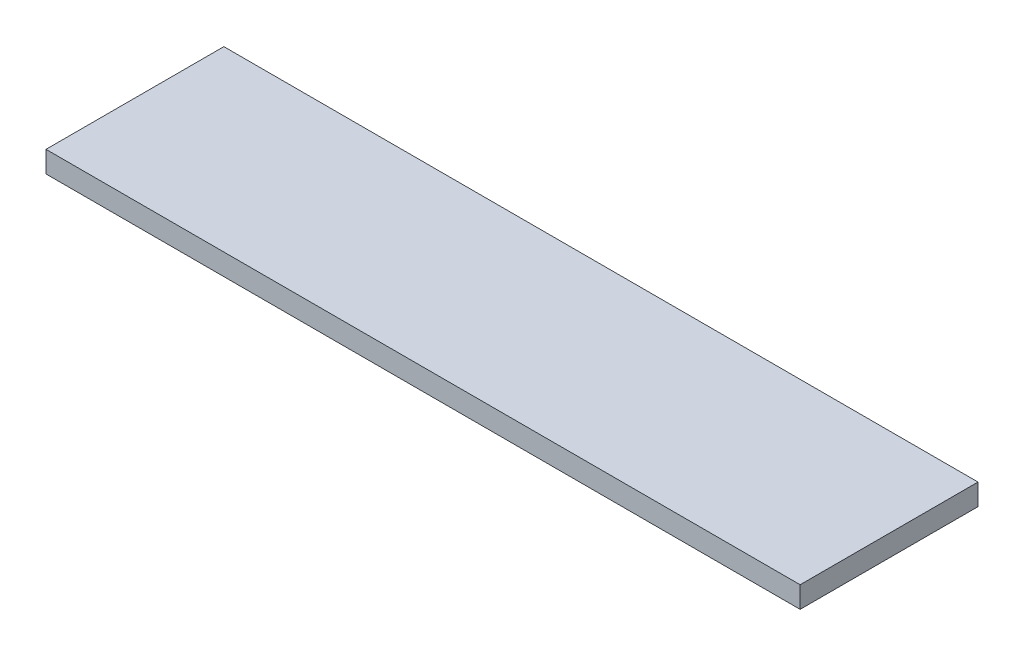
from build123d import *

# Parameters (mm, degrees)
SKETCH1_W           = 212
SKETCH1_H           = 50
BOSS_EXTRUDE1_DEPTH = 6


with BuildPart() as part:
    # Sketch1 → Boss-Extrude1 (new body)
    with BuildSketch(Plane(origin=(0, 0, 0), x_dir=(1, 0, 0), z_dir=(0, 1, 0))):
        with Locations((106, 25)):
            Rectangle(SKETCH1_W, SKETCH1_H)
    extrude(amount=BOSS_EXTRUDE1_DEPTH)


solid = part.part
